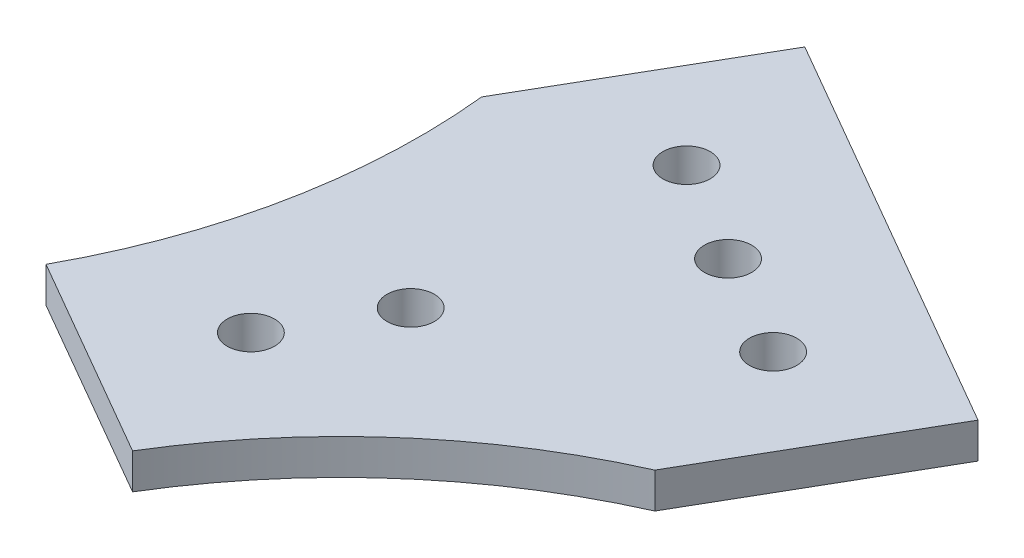
from build123d import *

# Parameters (mm, degrees)
SKETCH_1_R      = 2
EXTRUDE_1_DEPTH = 3


with BuildPart() as part:
    # 草图1 → 凸台-拉伸1 (new body)
    with BuildSketch(Plane(origin=(0, 0, 0), x_dir=(1, 0, 0), z_dir=(0, 1, 0))):
        with BuildLine():
            Line((-5.337642525, 6.81342157), (4.662357475, 24.133929646))
            Line((4.662357475, 24.133929646), (-29.978658676, 44.133929646))
            Line((-29.978658676, 44.133929646), (-39.978658676, 26.81342157))
            ThreePointArc((-39.978658676, 26.81342157), (-40.718178371, 11.008358068), (-46.138912714, -3.856451411))
            Line((-46.138912714, -3.856451411), (-28.818404638, -13.856451411))
            ThreePointArc((-28.818404638, -13.856451411), (-18.655469178, -1.729553023), (-5.337642525, 6.81342157))
        make_face()
        with Locations(Location((-26.318404638, 30.473675608, 0), (0, 0, 270))):
            Circle(SKETCH_1_R, mode=Mode.SUBTRACT)
        with Locations(Location((-17.713393416, 25.377992244, 0), (0, 0, 270))):
            Circle(SKETCH_1_R, mode=Mode.SUBTRACT)
        with Locations(Location((-8.997896563, 20.473675608, 0), (0, 0, 270))):
            Circle(SKETCH_1_R, mode=Mode.SUBTRACT)
        with Locations(Location((-27.533901492, 8.368373301, 0), (0, 0, 270))):
            Circle(SKETCH_1_R, mode=Mode.SUBTRACT)
        with Locations(Location((-32.478658676, -0.196197373, 0), (0, 0, 270))):
            Circle(SKETCH_1_R, mode=Mode.SUBTRACT)
    extrude(amount=EXTRUDE_1_DEPTH)


solid = part.part
